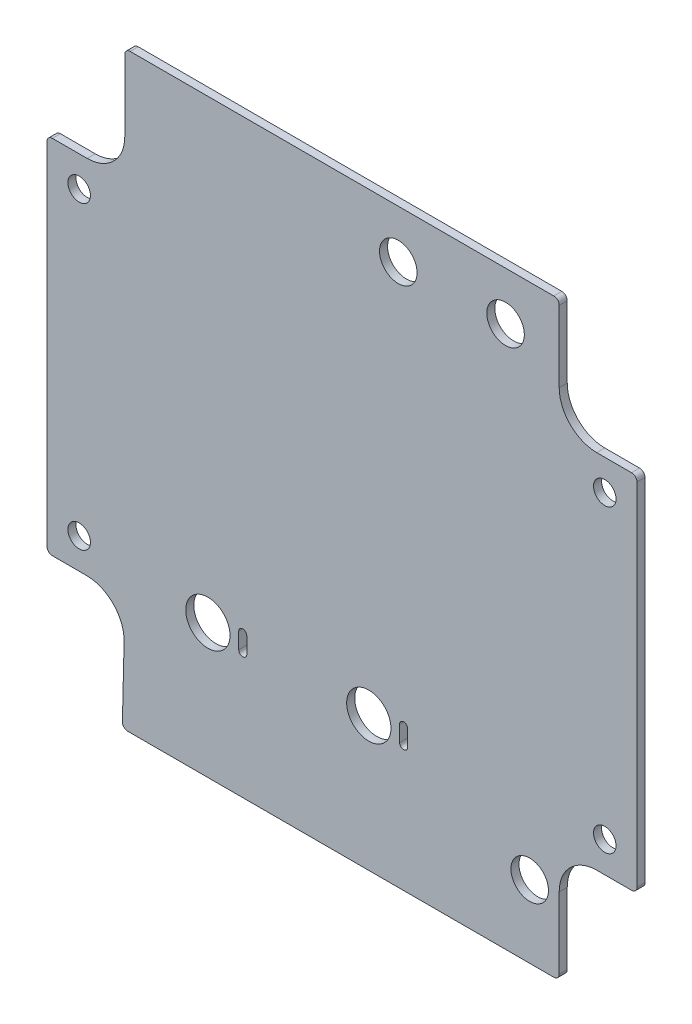
from build123d import *

# Parameters (mm, degrees)
EXTRUDE_1_DEPTH     = 1.5
HOLE_WIZARD_M4_1_D  = 4.2
HOLE_WIZARD_M8_1_D  = 8.25
SKETCH_8_R          = 3.5
CUT_EXTRUDE_1_DEPTH = 144.323608762
SKETCH_9_R          = 3.5
CUT_EXTRUDE_2_DEPTH = 144.323608762
CUT_EXTRUDE_3_DEPTH = 144.323608762


with BuildPart() as part:
    # 草圖1 → 填料-伸長1 (new body)
    with BuildSketch(Plane.XY):
        with BuildLine():
            Line((9.519190028, -18.946187519), (9.519190028, -5.659090909))
            ThreePointArc((9.519190028, -5.659090909), (9.226296809, -4.951984128), (8.519190028, -4.659090909))
            Line((8.519190028, -4.659090909), (-70.48081017, -4.659090909))
            ThreePointArc((-70.48081017, -4.659090909), (-71.187916951, -4.951984128), (-71.48081017, -5.659090909))
            Line((-71.48081017, -5.659090909), (-71.48081017, -18.946187519))
            ThreePointArc((-71.48081017, -18.946187519), (-73.531062702, -23.895934988), (-78.48081017, -25.946187519))
            Line((-78.48081017, -25.946187519), (-84.980810071, -25.946187519))
            ThreePointArc((-84.980810071, -25.946187519), (-85.687916853, -26.239080738), (-85.980810071, -26.946187519))
            Line((-85.980810071, -26.946187519), (-85.980810071, -92.341911374))
            ThreePointArc((-85.980810071, -92.341911374), (-85.688840793, -93.048093006), (-84.983425077, -93.341907955))
            Line((-84.983425077, -93.341907955), (-78.583599692, -93.358643592))
            ThreePointArc((-78.583599692, -93.358643592), (-73.586751521, -95.475153852), (-71.603919064, -100.526538095))
            Line((-71.603919064, -100.526538095), (-71.918462387, -113.635102561))
            ThreePointArc((-71.918462387, -113.635102561), (-71.634287831, -114.357665047), (-70.918750149, -114.659090909))
            Line((-70.918750149, -114.659090909), (8.519190028, -114.659090909))
            ThreePointArc((8.519190028, -114.659090909), (9.226296809, -114.36619769), (9.519190028, -113.659090909))
            Line((9.519190028, -113.659090909), (9.519190028, -100.371994299))
            ThreePointArc((9.519190028, -100.371994299), (11.569442559, -95.422246831), (16.519190028, -93.371994299))
            Line((16.519190028, -93.371994299), (23.019189929, -93.371994299))
            ThreePointArc((23.019189929, -93.371994299), (23.72629671, -93.07910108), (24.019189929, -92.371994299))
            Line((24.019189929, -92.371994299), (24.019189929, -26.946187519))
            ThreePointArc((24.019189929, -26.946187519), (23.72629671, -26.239080738), (23.019189929, -25.946187519))
            Line((23.019189929, -25.946187519), (16.519190028, -25.946187519))
            ThreePointArc((16.519190028, -25.946187519), (11.569442559, -23.895934988), (9.519190028, -18.946187519))
        make_face()
    extrude(amount=EXTRUDE_1_DEPTH)

    # M4 螺旋的螺孔鑽1 (through all)
    with Locations(Plane(origin=(0, 0, 0), x_dir=(-1, 0, 0), z_dir=(0, 0, -1))):
        with Locations((79.980810071, -87.644049447), (-18.019189929, -87.644049447), (-18.019189929, -31.644049447), (79.980810071, -31.644049447)):
            Hole(HOLE_WIZARD_M4_1_D / 2)

    # M8 螺旋的螺孔鑽1 (through all)
    with Locations(Plane.XY.offset(1.5)):
        with Locations((-55.980810071, -89.659090909), (-25.980810071, -89.659090909)):
            Hole(HOLE_WIZARD_M8_1_D / 2)

    # 草圖8 → 除料-伸長1 (cut, through all)
    with BuildSketch(Plane.XY.offset(1.5)):
        with Locations((4.019190028, -101.159090909)):
            Circle(SKETCH_8_R)
    extrude(amount=-CUT_EXTRUDE_1_DEPTH, mode=Mode.SUBTRACT)

    # 草圖9 → 除料-伸長2 (cut, through all)
    with BuildSketch(Plane.XY.offset(1.5)):
        with Locations((-0.480809972, -13.659090909)):
            Circle(SKETCH_9_R)
        with Locations((-20.480809972, -13.659090909)):
            Circle(SKETCH_9_R)
    extrude(amount=-CUT_EXTRUDE_2_DEPTH, mode=Mode.SUBTRACT)

    # 草圖10 → 除料-伸長3 (cut, through all)
    with BuildSketch(Plane.XY.offset(1.5)):
        with BuildLine():
            Line((-50.230810071, -91.159090909), (-50.230810071, -88.159090909))
            ThreePointArc((-50.230810071, -88.159090909), (-49.480810071, -87.409090909), (-48.730810071, -88.159090909))
            Line((-48.730810071, -88.159090909), (-48.730810071, -91.159090909))
            ThreePointArc((-48.730810071, -91.159090909), (-49.480810071, -91.909090909), (-50.230810071, -91.159090909))
        make_face()
        with BuildLine():
            Line((-20.230810071, -91.159090909), (-20.230810071, -88.159090909))
            ThreePointArc((-20.230810071, -88.159090909), (-19.480810071, -87.409090909), (-18.730810071, -88.159090909))
            Line((-18.730810071, -88.159090909), (-18.730810071, -91.159090909))
            ThreePointArc((-18.730810071, -91.159090909), (-19.480810071, -91.909090909), (-20.230810071, -91.159090909))
        make_face()
    extrude(amount=-CUT_EXTRUDE_3_DEPTH, mode=Mode.SUBTRACT)


solid = part.part
